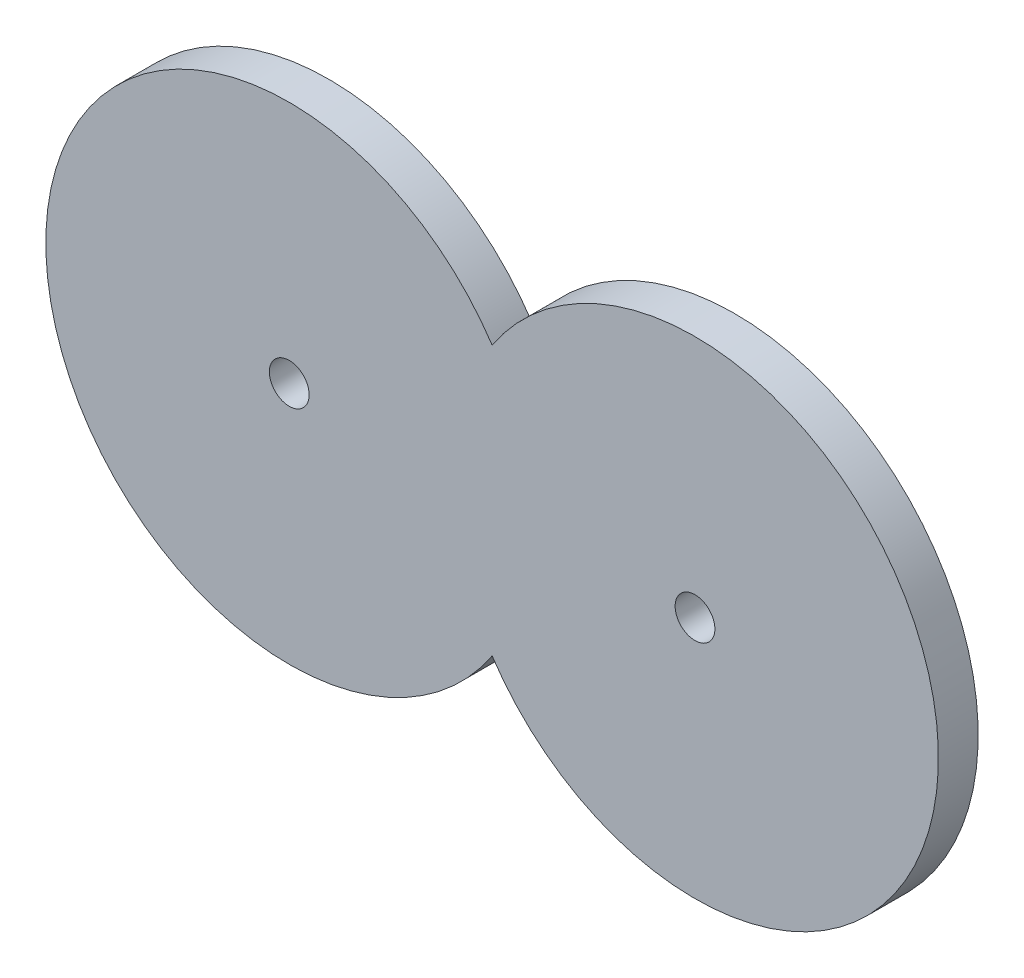
from build123d import *

# Parameters (mm, degrees)
BOSS_EXTRUDE1_DEPTH = 6.223


with BuildPart() as part:
    # Sketch1 → Boss-Extrude1 (new body)
    with BuildSketch(Plane.XY):
        with BuildLine():
            Line((0, 15.9385), (0, 0))
            Line((0, 0), (30.504432116, 0))
            ThreePointArc((30.504432116, 0), (25.4, 19.05), (30.504432116, 38.1))
            Line((30.504432116, 38.1), (0, 38.1))
            Line((0, 38.1), (0, 22.1615))
            ThreePointArc((0, 22.1615), (2.20016275, 21.25016275), (3.1115, 19.05))
            ThreePointArc((3.1115, 19.05), (2.20016275, 16.84983725), (0, 15.9385))
        make_face()
        with BuildLine():
            Line((30.504432116, 0), (0, 0))
            Line((0, 0), (0, 15.9385))
            ThreePointArc((0, 15.9385), (-3.1115, 19.05), (0, 22.1615))
            Line((0, 22.1615), (0, 38.1))
            Line((0, 38.1), (30.504432116, 38.1))
            ThreePointArc((30.504432116, 38.1), (31.111611101, 39.114951146), (31.75, 40.110567419))
            ThreePointArc((31.75, 40.110567419), (-38.1, 19.05), (31.75, -2.010567419))
            ThreePointArc((31.75, -2.010567419), (31.111611101, -1.014951146), (30.504432116, 0))
        make_face()
        with BuildLine():
            ThreePointArc((31.75, 40.110567419), (31.111611101, 39.114951146), (30.504432116, 38.1))
            Line((30.504432116, 38.1), (32.995567884, 38.1))
            ThreePointArc((32.995567884, 38.1), (32.388388899, 39.114951146), (31.75, 40.110567419))
        make_face()
        with BuildLine():
            Line((63.5, 0), (32.995567884, 0))
            ThreePointArc((32.995567884, 0), (32.388388899, -1.014951146), (31.75, -2.010567419))
            ThreePointArc((31.75, -2.010567419), (74.498522628, -17.427972806), (101.6, 19.05))
            ThreePointArc((101.6, 19.05), (74.498522628, 55.527972806), (31.75, 40.110567419))
            ThreePointArc((31.75, 40.110567419), (32.388388899, 39.114951146), (32.995567884, 38.1))
            Line((32.995567884, 38.1), (63.5, 38.1))
            Line((63.5, 38.1), (63.5, 22.1615))
            ThreePointArc((63.5, 22.1615), (65.70016275, 21.25016275), (66.6115, 19.05))
            ThreePointArc((66.6115, 19.05), (65.70016275, 16.84983725), (63.5, 15.9385))
            Line((63.5, 15.9385), (63.5, 0))
        make_face()
        with BuildLine():
            ThreePointArc((30.504432116, 38.1), (25.4, 19.05), (30.504432116, 0))
            Line((30.504432116, 0), (32.995567884, 0))
            ThreePointArc((32.995567884, 0), (36.801773982, 9.188994382), (38.1, 19.05))
            ThreePointArc((38.1, 19.05), (36.801773982, 28.911005618), (32.995567884, 38.1))
            Line((32.995567884, 38.1), (30.504432116, 38.1))
        make_face()
        with BuildLine():
            ThreePointArc((38.1, 19.05), (36.801773982, 9.188994382), (32.995567884, 0))
            Line((32.995567884, 0), (63.5, 0))
            Line((63.5, 0), (63.5, 15.9385))
            ThreePointArc((63.5, 15.9385), (60.3885, 19.05), (63.5, 22.1615))
            Line((63.5, 22.1615), (63.5, 38.1))
            Line((63.5, 38.1), (32.995567884, 38.1))
            ThreePointArc((32.995567884, 38.1), (36.801773982, 28.911005618), (38.1, 19.05))
        make_face()
        with BuildLine():
            Line((32.995567884, 0), (30.504432116, 0))
            ThreePointArc((30.504432116, 0), (31.111611101, -1.014951146), (31.75, -2.010567419))
            ThreePointArc((31.75, -2.010567419), (32.388388899, -1.014951146), (32.995567884, 0))
        make_face()
    extrude(amount=BOSS_EXTRUDE1_DEPTH)


solid = part.part
